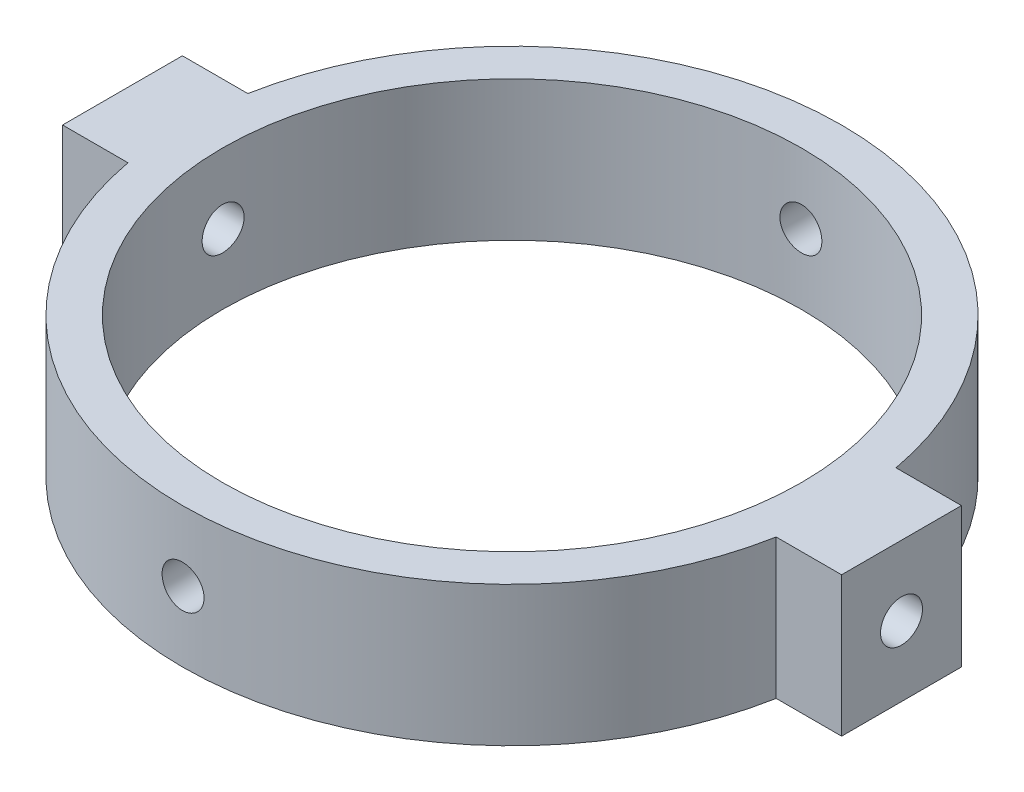
from build123d import *

# Parameters (mm, degrees)
SKETCH1_R               = 33
SKETCH1_R_2             = 29
BOSS_EXTRUDE1_DEPTH     = 7
SKETCH2_W               = 10
SKETCH2_H               = 12
BOSS_EXTRUDE2_DEPTH     = 7
SKETCH5_R               = 2.1
CUT_EXTRUDE1_DEPTH      = 85.982351109
CUT_EXTRUDE4_DEPTH      = 52.565492427
CUT_EXTRUDE4_DEPTH_BACK = 52.565492427
SKETCH7_R               = 2.1


with BuildPart() as part:
    # Sketch1 → Boss-Extrude1 (new, symmetric)
    with BuildSketch(Plane(origin=(0, 0, 0), x_dir=(1, 0, 0), z_dir=(0, 1, 0))):
        with Locations(Location((0, 0, 0), (0, 0, 270))):
            Circle(SKETCH1_R)
        with Locations(Location((0, 0, 0), (0, 0, 270))):
            Circle(SKETCH1_R_2, mode=Mode.SUBTRACT)
    extrude(amount=BOSS_EXTRUDE1_DEPTH, both=True)

    # Sketch2 → Boss-Extrude2 (add, symmetric)
    with BuildSketch(Plane(origin=(0, 0, 0), x_dir=(1, 0, 0), z_dir=(0, 1, 0))):
        with Locations((34, 0)):
            Rectangle(SKETCH2_W, SKETCH2_H)
        with Locations((-34, 0)):
            Rectangle(SKETCH2_W, SKETCH2_H)
    extrude(amount=BOSS_EXTRUDE2_DEPTH, both=True)

    # Sketch5 → Cut-Extrude1 (cut, through all)
    with BuildSketch(Plane.ZY.offset(39)):
        Circle(SKETCH5_R)
    extrude(amount=-CUT_EXTRUDE1_DEPTH, mode=Mode.SUBTRACT)

    # Sketch7 → Cut-Extrude4 (cut, two sides: drawn at the far end of the back side and taken through both)
    with BuildSketch(Plane.XY.offset(-CUT_EXTRUDE4_DEPTH_BACK)):
        Circle(SKETCH7_R)
    extrude(amount=CUT_EXTRUDE4_DEPTH + CUT_EXTRUDE4_DEPTH_BACK, mode=Mode.SUBTRACT)


solid = part.part
